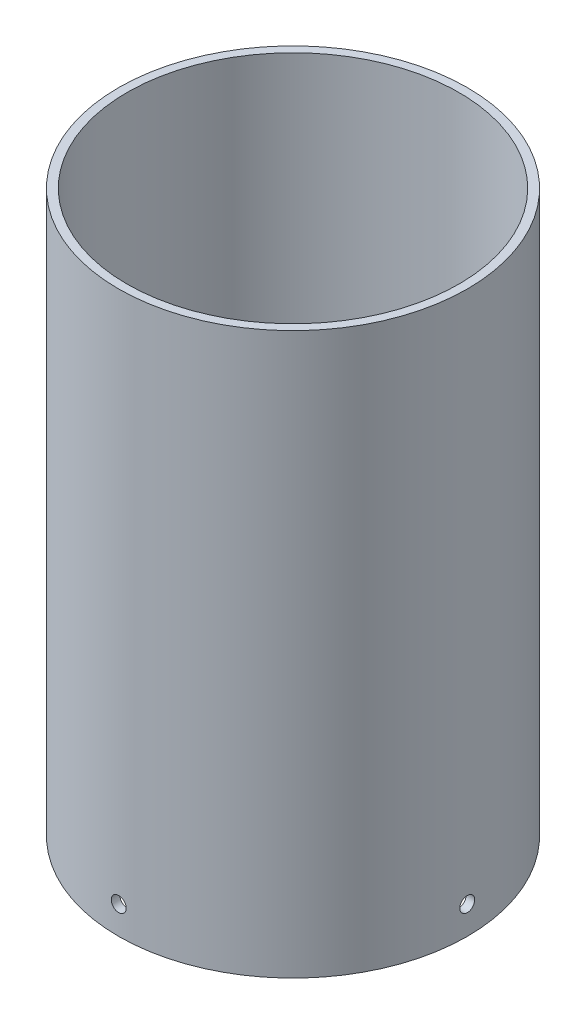
from build123d import *

# Parameters (mm, degrees)
IZIM1_R                     = 62.2
IZIM1_R_2                   = 59.2
Y_KSEKLIK_EKSTR_ZYON1_DEPTH = 100
DAIRESEL_KAPLAMA1_COUNT     = 4


with BuildPart() as part:
    # Çizim1 → Yükseklik-Ekstrüzyon1 (new, symmetric)
    with BuildSketch(Plane(origin=(0, 0, 0), x_dir=(1, 0, 0), z_dir=(0, 1, 0))):
        with Locations(Location((0, 0, 0), (0, 0, 270))):
            Circle(IZIM1_R)
        with Locations(Location((0, 0, 0), (0, 0, 270))):
            Circle(IZIM1_R_2, mode=Mode.SUBTRACT)
    extrude(amount=Y_KSEKLIK_EKSTR_ZYON1_DEPTH, both=True)

    # Çizim10 → M5 Boşluklu Delik1 (revolve, cut)
    with BuildSketch(Plane(origin=(62.2, -90, 0), x_dir=(0, 0, -1), z_dir=(0, 1, 0))):
        Polygon((0, 0), (0, 10.29228064), (2.65, 8.7), (2.65, 0), align=None)
    m5_bo_luklu_delik1 = revolve(axis=Axis((68.55, -90, 0), (-1, 0, 0)), mode=Mode.SUBTRACT)

    # Dairesel Kaplama1: M5 Boşluklu Delik1 ×4 about axis
    dairesel_kaplama1_axis = Axis((0, -100, 0), (0, 1, 0))
    for i in range(1, DAIRESEL_KAPLAMA1_COUNT):
        add(m5_bo_luklu_delik1.rotate(dairesel_kaplama1_axis, i * 360 / DAIRESEL_KAPLAMA1_COUNT), mode=Mode.SUBTRACT)


solid = part.part
